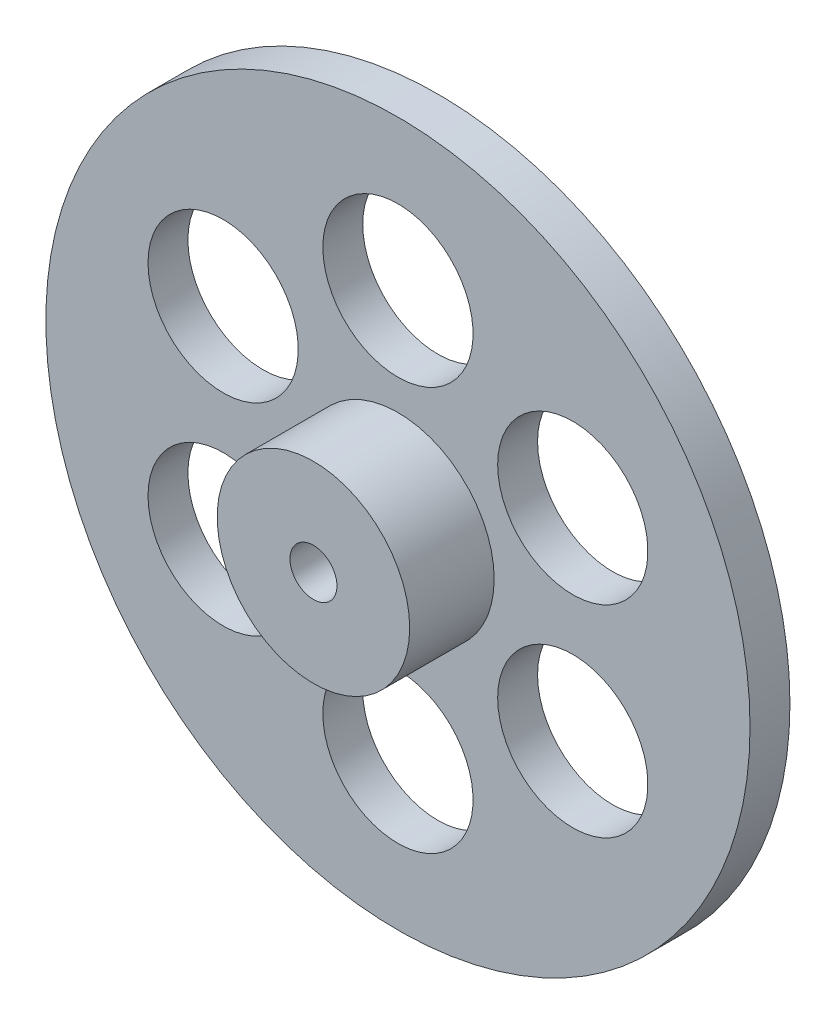
from build123d import *

# Parameters (mm, degrees)
SKETCH3_R          = 1.6
CUT_EXTRUDE1_DEPTH = 11.932634632
CIRPATTERN1_COUNT  = 6


with BuildPart() as part:
    # Sketch1 → Revolve1 (revolve)
    with BuildSketch(Plane(origin=(0, 0, 0), x_dir=(0, 0, -1), z_dir=(1, 0, 0)), mode=Mode.PRIVATE) as revolve1_sk:
        Polygon((0, 0.5), (0, 2.05), (1.8, 2.05), (1.8, 7.5), (2.65, 7.5), (2.65, 1.5), (3, 1.5), (3, 0.5), align=None)
    revolve(revolve1_sk.sketch.rotate(Axis((0, 0, 128.698308515), (0, 0, -1)), 90), axis=Axis((0, 0, 128.698308515), (0, 0, -1)))

    # Sketch3 → Cut-Extrude1 (cut, through all)
    with BuildSketch(Plane(origin=(0, 0, -2.65), x_dir=(-1, 0, 0), z_dir=(0, 0, -1))):
        with Locations((0, 4.3)):
            Circle(SKETCH3_R)
    cut_extrude1 = extrude(amount=-CUT_EXTRUDE1_DEPTH, mode=Mode.SUBTRACT)

    # CirPattern1: Cut-Extrude1 ×6 about axis
    cirpattern1_axis = Axis((0, 0, 0), (0, 0, 1))
    for i in range(1, CIRPATTERN1_COUNT):
        add(cut_extrude1.rotate(cirpattern1_axis, i * 360 / CIRPATTERN1_COUNT), mode=Mode.SUBTRACT)


solid = part.part
